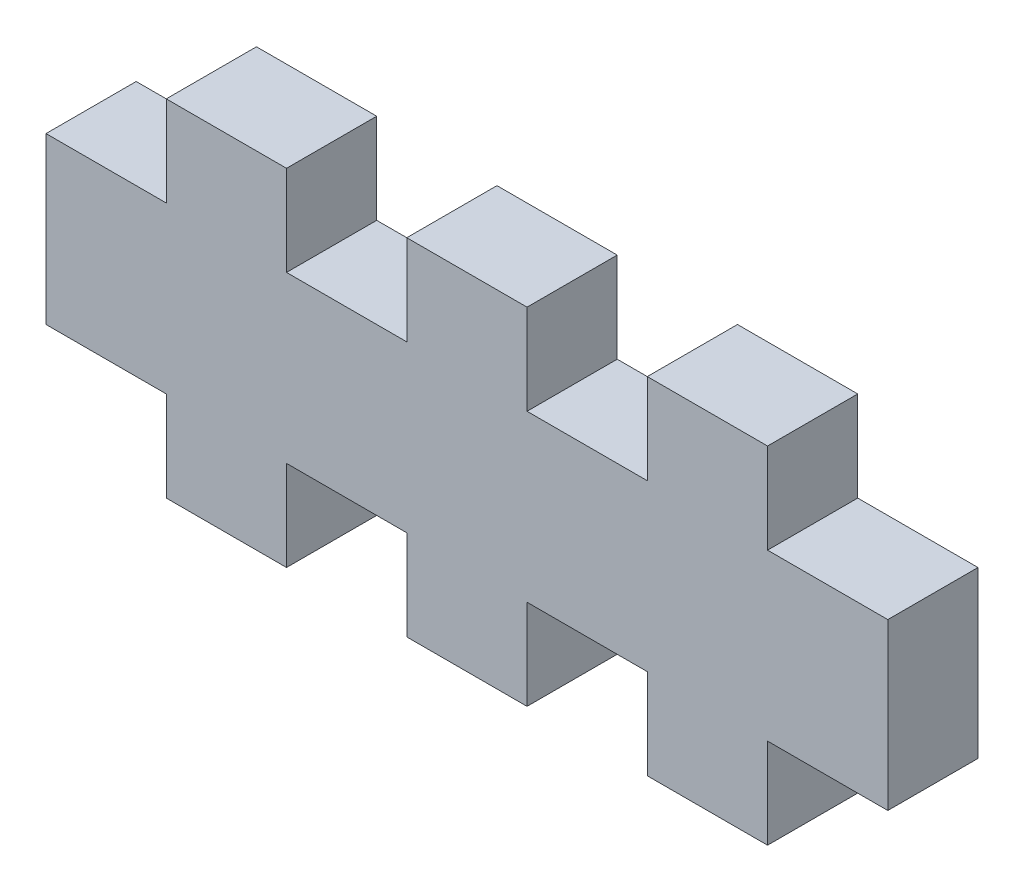
from build123d import *

# Parameters (mm, degrees)
SALIENTE_EXTRUIR1_DEPTH = 3


with BuildPart() as part:
    # Croquis1 → Saliente-Extruir1 (new body)
    with BuildSketch(Plane.XY):
        Polygon((-10, -2.75), (-10, -5.75), (-6, -5.75), (-6, -2.75), (-2, -2.75), (-2, -5.75), (2, -5.75), (2, -2.75), (6, -2.75), (6, -5.75), (10, -5.75), (10, -2.75), (14, -2.75), (14, 2.75), (10, 2.75), (10, 5.75), (6, 5.75), (6, 2.75), (2, 2.75), (2, 5.75), (-2, 5.75), (-2, 2.75), (-6, 2.75), (-6, 5.75), (-10, 5.75), (-10, 2.75), (-14, 2.75), (-14, -2.75), align=None)
    extrude(amount=SALIENTE_EXTRUIR1_DEPTH)


solid = part.part
